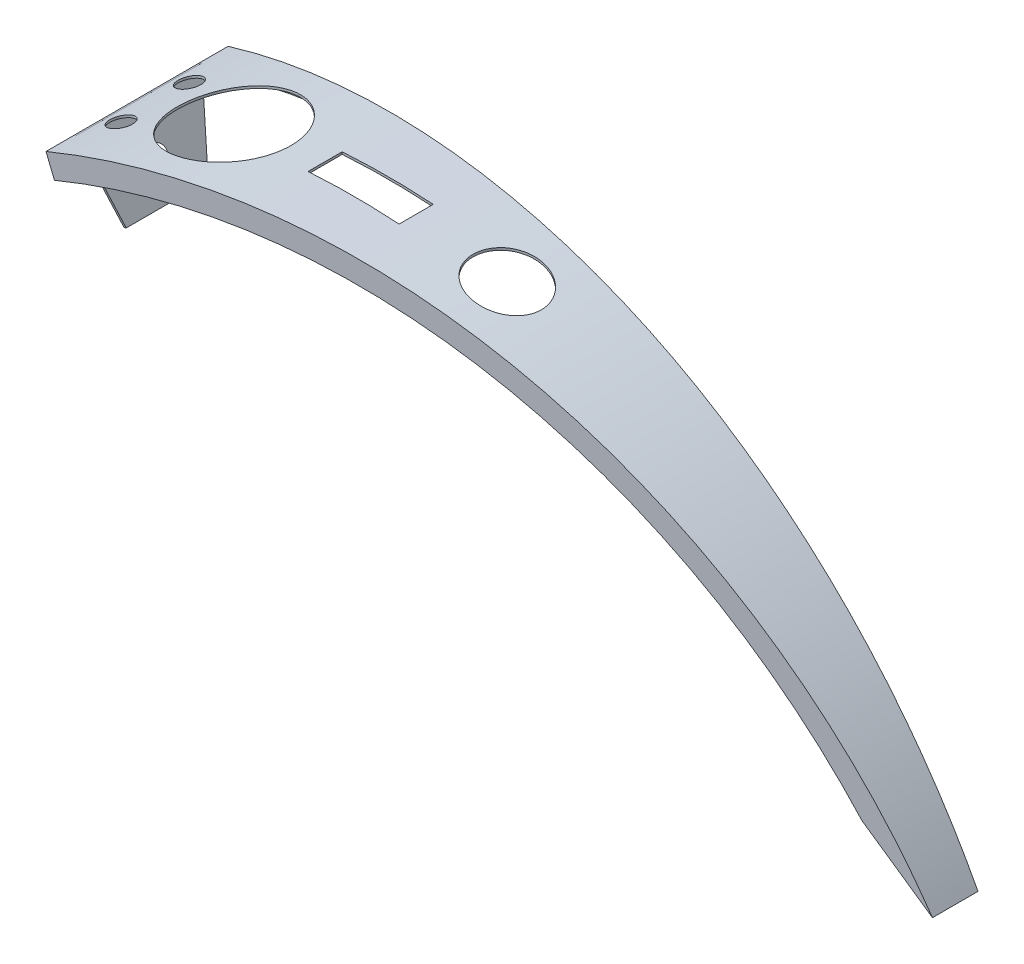
from build123d import *

# Parameters (mm, degrees)
EXTRUDE_1_DEPTH     = 40
CUT_EXTRUDE_1_DEPTH = 397.915070509
SHELL_2_T           = -1
SKETCH_3_W          = 40
SKETCH_3_H          = 15
CUT_EXTRUDE_2_DEPTH = 397.915070509
SKETCH_4_R          = 25
SKETCH_4_R_2        = 15
SKETCH_4_R_3        = 5
CUT_EXTRUDE_3_DEPTH = 397.915070509
CUT_EXTRUDE_4_DEPTH = 40
EXTRUDE_2_DEPTH     = 1
SKETCH_7_R          = 5
CUT_EXTRUDE_5_DEPTH = 1
MM_1_D              = 1
MM_1_DEPTH          = 12.4
MM_1_CSINK_D        = 12.8
MM_1_CSINK_ANGLE    = 90
MM_1_TIP            = 0.30043031


with BuildPart() as part:
    # 草图1 → 凸台-拉伸1 (new, symmetric)
    with BuildSketch(Plane.XY):
        with BuildLine():
            Line((-102.606042998, 281.907786236), (-99.185841564, 272.510860028))
            ThreePointArc((-99.185841564, 272.510860028), (96.486714963, 273.478177988), (248.231216272, 149.937531219))
            Line((248.231216272, 149.937531219), (256.790913385, 155.107790916))
            ThreePointArc((256.790913385, 155.107790916), (99.813843065, 282.908459988), (-102.606042998, 281.907786236))
        make_face()
    extrude(amount=EXTRUDE_1_DEPTH, both=True)

    # 草图2 → 切除-拉伸1 (cut, through all)
    with BuildSketch(Plane(origin=(0, 0, 0), x_dir=(1, 0, 0), z_dir=(0, 1, 0))):
        Polygon((-102.606042998, 40), (256.790913385, 40), (256.790913385, 10), align=None)
        Polygon((256.790913385, -40), (256.790913385, -10), (-102.606042998, -40), align=None)
    extrude(amount=CUT_EXTRUDE_1_DEPTH, mode=Mode.SUBTRACT)

    # 抽壳2
    shell_2_openings = [part.faces().sort_by_distance(p)[0] for p in [
        (96.486714963, 273.478177988, 0),
    ]]
    offset(amount=SHELL_2_T, openings=shell_2_openings, kind=Kind.INTERSECTION)

    # 草图3 → 切除-拉伸2 (cut, through all)
    with BuildSketch(Plane(origin=(0, 0, 0), x_dir=(1, 0, 0), z_dir=(0, 1, 0))):
        Rectangle(SKETCH_3_W, SKETCH_3_H)
    extrude(amount=CUT_EXTRUDE_2_DEPTH, mode=Mode.SUBTRACT)

    # 草图4 → 切除-拉伸3 (cut, through all)
    with BuildSketch(Plane(origin=(0, 0, 0), x_dir=(1, 0, 0), z_dir=(0, 1, 0))):
        with Locations(Location((-60, 0, 0), (0, 0, 90))):
            Circle(SKETCH_4_R)
        with Locations(Location((60, 0, 0), (0, 0, 90))):
            Circle(SKETCH_4_R_2)
        with Locations(Location((-94.606042998, 15, 0), (0, 0, 90))):
            Circle(SKETCH_4_R_3)
        with Locations(Location((-94.606042998, -15, 0), (0, 0, 90))):
            Circle(SKETCH_4_R_3)
    extrude(amount=CUT_EXTRUDE_3_DEPTH, mode=Mode.SUBTRACT)

    # 草图5 → 切除-拉伸4 (cut, symmetric)
    with BuildSketch(Plane.XY):
        Polygon((256.790913385, 155.107790916), (228.27486074, 178.859128797), (202.085250624, 147.415666345), (242.532887063, 124.067442195), align=None)
    extrude(amount=CUT_EXTRUDE_4_DEPTH, both=True, mode=Mode.SUBTRACT)

    # 草图6 → 凸台-拉伸2 (add)
    with BuildSketch(Plane(origin=(0, 0, 0), x_dir=(0, 0, 1), z_dir=(-0.9396926207859102, -0.34202014332566405, 0))):
        Polygon((-27.5, 300), (-18, 264), (18, 264), (27.5, 300), align=None)
    extrude(amount=-EXTRUDE_2_DEPTH)

    # 草图7 → 切除-拉伸5 (cut)
    with BuildSketch(Plane(origin=(0, 0, 0), x_dir=(0, 0, 1), z_dir=(-0.9396926207859102, -0.34202014332566405, 0))):
        with Locations(Location((0, 279.238588323, 0), (0, 0, 270))):
            Circle(SKETCH_7_R)
    extrude(amount=-CUT_EXTRUDE_5_DEPTH, mode=Mode.SUBTRACT)

    # 大小mm 暗销孔1
    with Locations(Plane(origin=(0, 0, 0), x_dir=(0, 0, 1), z_dir=(-0.9396926207859102, -0.34202014332566405, 0))):
        with Locations((0, 279.238588323)):
            CounterSinkHole(MM_1_D / 2, MM_1_CSINK_D / 2, depth=MM_1_DEPTH, counter_sink_angle=MM_1_CSINK_ANGLE)
            with Locations((0, 0, -(MM_1_DEPTH + MM_1_TIP / 2))):  # 118° drill point
                Cone(0, MM_1_D / 2, MM_1_TIP, mode=Mode.SUBTRACT)


solid = part.part
